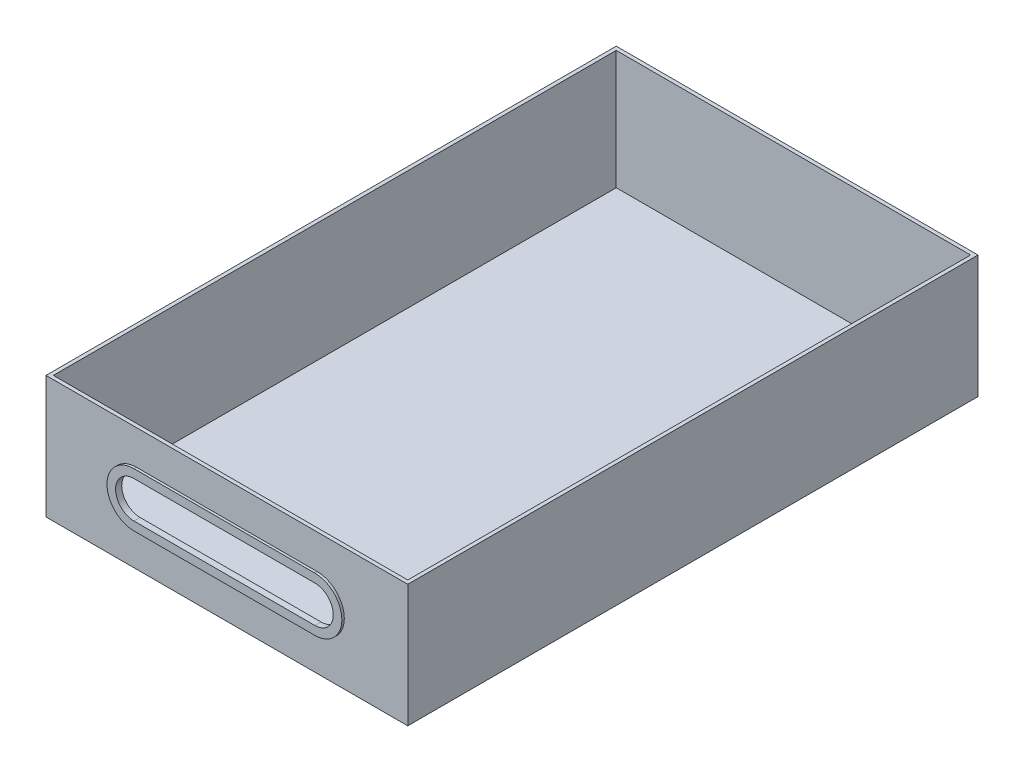
from build123d import *

# Parameters (mm, degrees)
SKETCH2_W           = 295
SKETCH2_H           = 465
BOSS_EXTRUDE1_DEPTH = 100
SHELL5_T            = -3
CUT_EXTRUDE5_DEPTH  = 462
BOSS_EXTRUDE2_START = 2
BOSS_EXTRUDE2_DEPTH = 2


with BuildPart() as part:
    # Sketch2 → Boss-Extrude1 (new body)
    with BuildSketch(Plane(origin=(0, 0, 0), x_dir=(1, 0, 0), z_dir=(0, 1, 0))):
        Rectangle(SKETCH2_W, SKETCH2_H)
    extrude(amount=-BOSS_EXTRUDE1_DEPTH)

    # Shell5
    shell5_openings = [part.faces().sort_by_distance(p)[0] for p in [
        (0, 0, 0),
    ]]
    offset(amount=SHELL5_T, openings=shell5_openings, kind=Kind.INTERSECTION)

    # Sketch3 → Cut-Extrude5 (cut)
    with BuildSketch(Plane.XY.offset(232.5)):
        with BuildLine():
            Line((-73.75, -35), (73.75, -35))
            ThreePointArc((73.75, -35), (88.75, -50), (73.75, -65))
            Line((73.75, -65), (-73.75, -65))
            ThreePointArc((-73.75, -65), (-88.75, -50), (-73.75, -35))
        make_face()
    extrude(amount=-CUT_EXTRUDE5_DEPTH, mode=Mode.SUBTRACT)

    # Sketch3<4> → Boss-Extrude2 (add)
    with BuildSketch(Plane.XY.offset(232.5).offset(BOSS_EXTRUDE2_START)):
        with BuildLine():
            Line((-73.75, -28), (73.75, -28))
            ThreePointArc((73.75, -28), (95.75, -50), (73.75, -72))
            Line((73.75, -72), (-73.75, -72))
            ThreePointArc((-73.75, -72), (-95.75, -50), (-73.75, -28))
        make_face()
        with BuildLine():
            Line((-73.75, -35), (73.75, -35))
            ThreePointArc((73.75, -35), (88.75, -50), (73.75, -65))
            Line((73.75, -65), (-73.75, -65))
            ThreePointArc((-73.75, -65), (-88.75, -50), (-73.75, -35))
        make_face(mode=Mode.SUBTRACT)
    extrude(amount=-BOSS_EXTRUDE2_DEPTH)


solid = part.part
